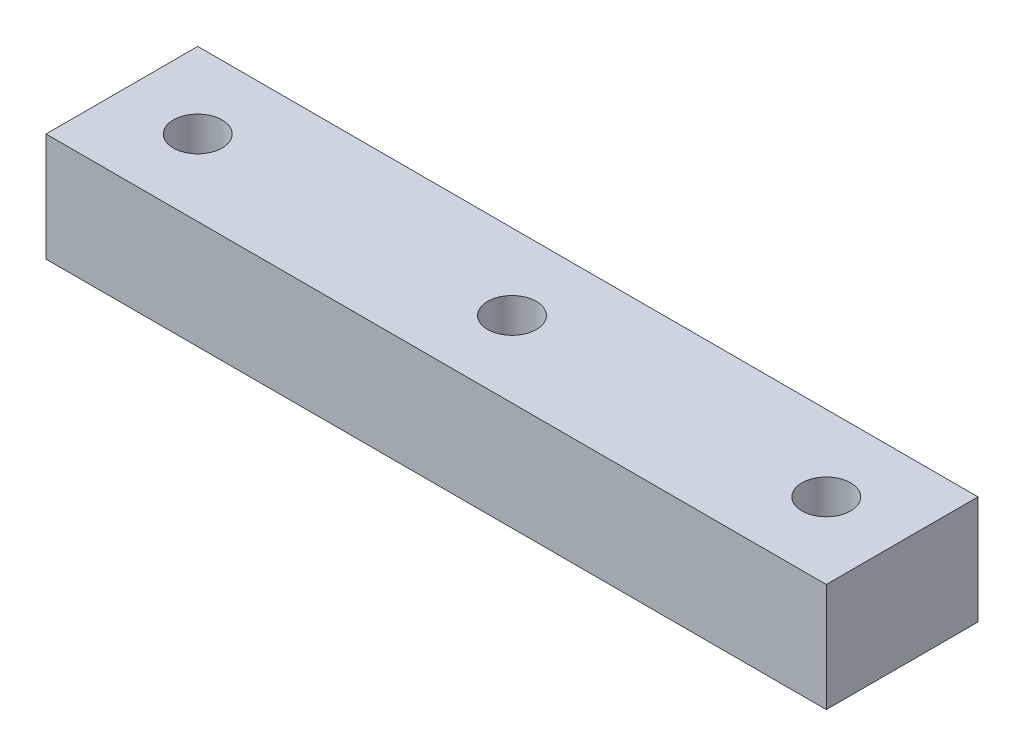
from build123d import *

# Parameters (mm, degrees)
SKETCH1_W           = 72
SKETCH1_H           = 14
SKETCH1_R           = 2.25
BOSS_EXTRUDE1_DEPTH = 10


with BuildPart() as part:
    # Sketch1 → Boss-Extrude1 (new body)
    with BuildSketch(Plane(origin=(0, 0, 0), x_dir=(1, 0, 0), z_dir=(0, 1, 0))):
        Rectangle(SKETCH1_W, SKETCH1_H)
        with Locations(Location((0, 0, 0), (0, 0, 270))):
            Circle(SKETCH1_R, mode=Mode.SUBTRACT)
        with Locations(Location((-29, 0, 0), (0, 0, 270))):
            Circle(SKETCH1_R, mode=Mode.SUBTRACT)
        with Locations(Location((29, 0, 0), (0, 0, 270))):
            Circle(SKETCH1_R, mode=Mode.SUBTRACT)
    extrude(amount=BOSS_EXTRUDE1_DEPTH)


solid = part.part
